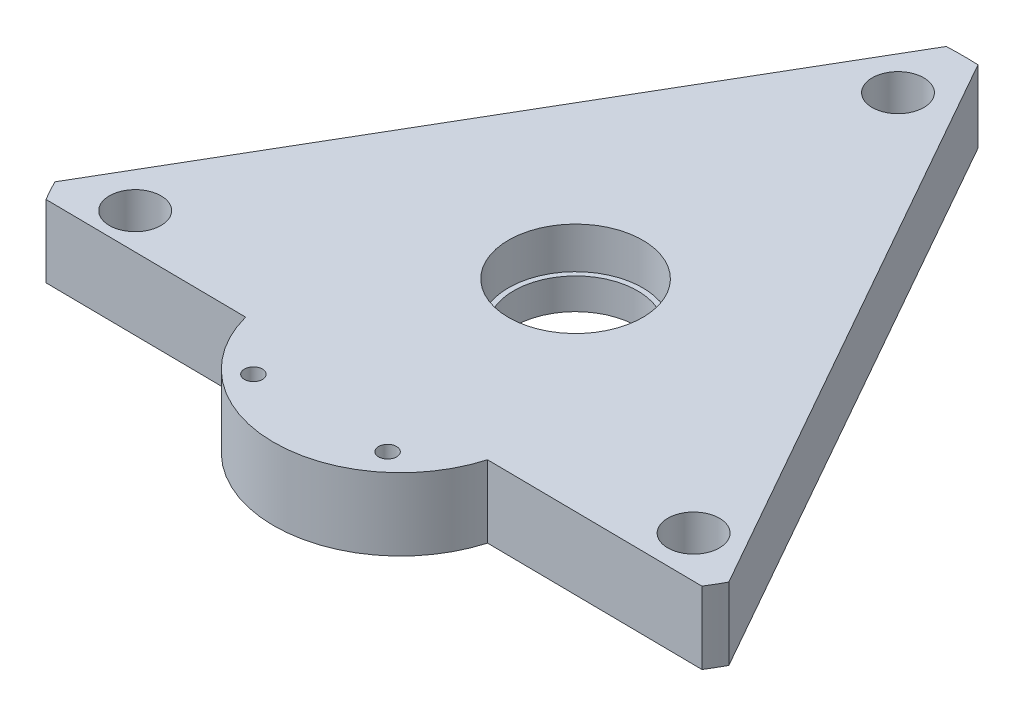
from build123d import *

# Parameters (mm, degrees)
SKETCH1_R           = 75
BOSS_EXTRUDE1_DEPTH = 14
SKETCH2_R           = 13
CUT_EXTRUDE1_DEPTH  = 8
SKETCH3_R           = 12
CUT_EXTRUDE2_DEPTH  = 8
SKETCH4_R           = 5
CUT_EXTRUDE4_DEPTH  = 107.98598039
SKETCH5_R           = 1.75
CUT_EXTRUDE5_DEPTH  = 107.98598039
CUT_EXTRUDE6_DEPTH  = 15


with BuildPart() as part:
    # Sketch1 → Boss-Extrude1 (new body)
    with BuildSketch(Plane(origin=(0, 0, 0), x_dir=(1, 0, 0), z_dir=(0, 1, 0))):
        with Locations(Location((0, 0, 0), (0, 0, 270))):
            Circle(SKETCH1_R)
    extrude(amount=BOSS_EXTRUDE1_DEPTH)

    # Sketch2 → Cut-Extrude1 (cut)
    with BuildSketch(Plane(origin=(0, 14, 0), x_dir=(1, 0, 0), z_dir=(0, 1, 0))):
        with Locations(Location((0, 0, 0), (0, 0, 270))):
            Circle(SKETCH2_R)
    extrude(amount=-CUT_EXTRUDE1_DEPTH, mode=Mode.SUBTRACT)

    # Sketch3 → Cut-Extrude2 (cut)
    with BuildSketch(Plane(origin=(0, 6, 0), x_dir=(1, 0, 0), z_dir=(0, 1, 0))):
        with Locations(Location((0, 0, 0), (0, 0, 270))):
            Circle(SKETCH3_R)
    extrude(amount=-CUT_EXTRUDE2_DEPTH, mode=Mode.SUBTRACT)

    # Sketch4 → Cut-Extrude4 (cut, through all)
    with BuildSketch(Plane(origin=(0, 14, 0), x_dir=(1, 0, 0), z_dir=(0, 1, 0))):
        with Locations(Location((0, 62.5, 0), (0, 0, 270))):
            Circle(SKETCH4_R)
        with Locations(Location((-54.126587737, -31.25, 0), (0, 0, 270))):
            Circle(SKETCH4_R)
        with Locations(Location((54.126587737, -31.25, 0), (0, 0, 270))):
            Circle(SKETCH4_R)
    extrude(amount=-CUT_EXTRUDE4_DEPTH, mode=Mode.SUBTRACT)

    # Sketch5 → Cut-Extrude5 (cut, through all)
    with BuildSketch(Plane(origin=(0, 14, 0), x_dir=(1, 0, 0), z_dir=(0, 1, 0))):
        with Locations(Location((-15.201634245, -47.250661584, 0), (0, 0, 270))):
            Circle(SKETCH5_R)
        with Locations(Location((10.798365755, -47.250661584, 0), (0, 0, 270))):
            Circle(SKETCH5_R)
    extrude(amount=-CUT_EXTRUDE5_DEPTH, mode=Mode.SUBTRACT)

    # Sketch6 → Cut-Extrude6 (cut)
    with BuildSketch(Plane(origin=(0, 0, 0), x_dir=(-1, 0, 0), z_dir=(0, -1, 0))):
        with BuildLine():
            ThreePointArc((75, 0), (54.10858072, 51.935166241), (3.073026868, 74.937016927))
            Line((3.073026868, 74.937016927), (66.751084117, -34.194923151))
            ThreePointArc((66.751084117, -34.194923151), (72.908611661, -17.587903389), (75, 0))
        make_face()
        with BuildLine():
            Line((-65.762802754, -36.059031794), (-3.073026868, 74.937016927))
            ThreePointArc((-3.073026868, 74.937016927), (-65.304085384, 36.883281201), (-65.762802754, -36.059031794))
        make_face()
        with BuildLine():
            ThreePointArc((-63.846861253, -39.351979723), (0.783642911, -74.995905914), (64.655219699, -38.009243162))
            Line((64.655219699, -38.009243162), (25.54691352, -38.417891428))
            ThreePointArc((25.54691352, -38.417891428), (2.039914544, -56.722875597), (-21.844452804, -38.91309057))
            Line((-21.844452804, -38.91309057), (-63.846861253, -39.351979723))
        make_face()
    extrude(amount=-CUT_EXTRUDE6_DEPTH, mode=Mode.SUBTRACT)


solid = part.part
